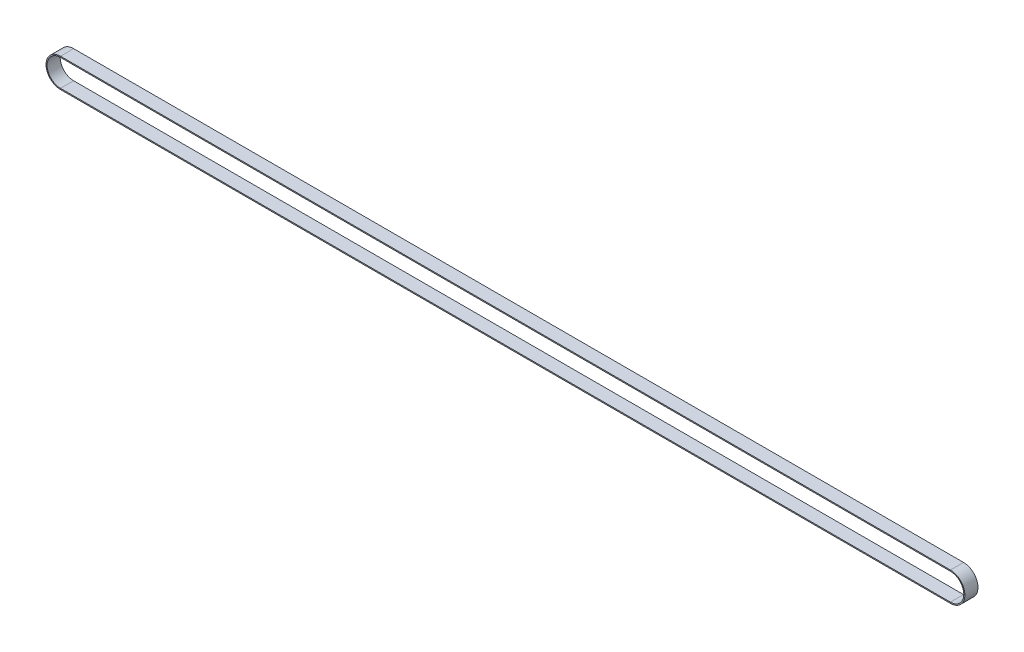
from build123d import *

# Parameters (mm, degrees)
SKETCH2_W = 6
SKETCH2_H = 0.5


with BuildPart() as part:
    # Sweep1: sweep along a path in Sketch1
    with BuildLine(Plane.XY) as sweep1_path:
        Line((-16, 4.931196244), (390.975, 4.931196244))
        ThreePointArc((390.975, 4.931196244), (397.085, -1.178803756), (390.975, -7.288803756))
        Line((390.975, -7.288803756), (-16, -7.288803756))
        ThreePointArc((-16, -7.288803756), (-22.11, -1.178803756), (-16, 4.931196244))
    # Sketch2 → Sweep1 (sweep)
    with BuildSketch(Plane(origin=(-16, 0, 0), x_dir=(0, 0, -1), z_dir=(1, 0, 0))):
        with Locations((0, 5.181196244)):
            Rectangle(SKETCH2_W, SKETCH2_H)
    sweep(path=sweep1_path.line)


solid = part.part
